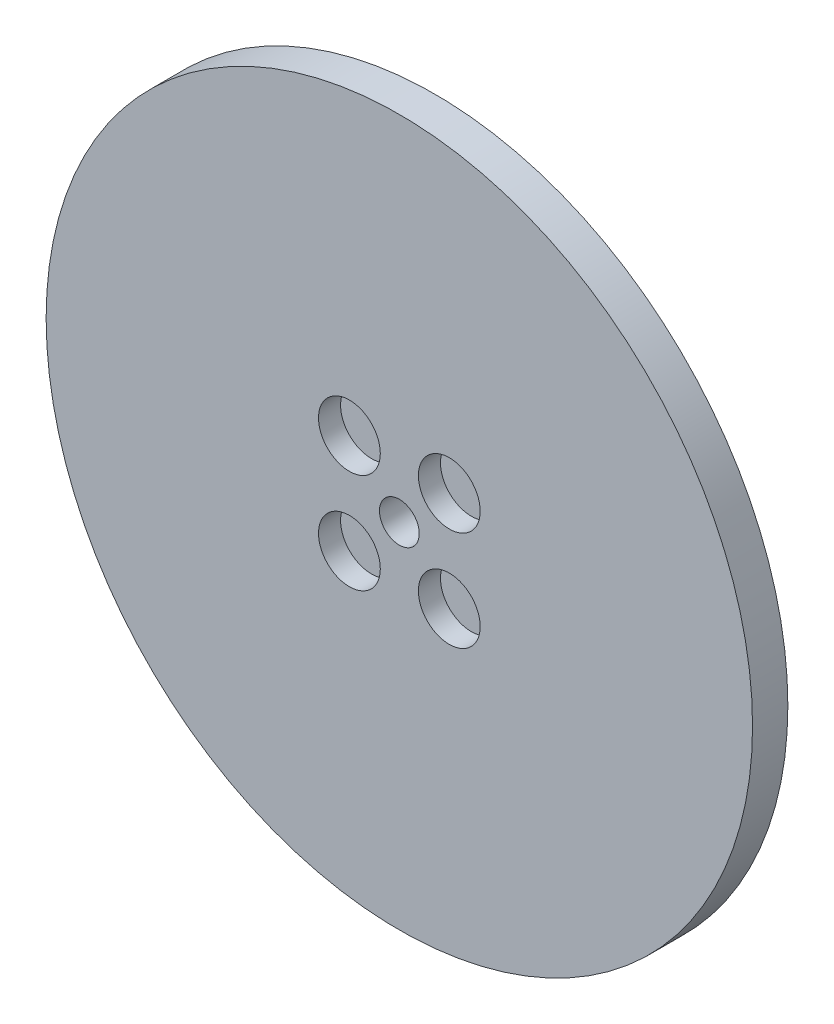
from build123d import *

# Parameters (mm, degrees)
SKETCH1_R           = 30
SKETCH1_R_2         = 12.5
BOSS_EXTRUDE1_DEPTH = 4
SKETCH2_R           = 40
SKETCH2_R_2         = 2.25
SKETCH2_R_3         = 1.5
BOSS_EXTRUDE2_DEPTH = 4
SKETCH3_R           = 3.5
CUT_EXTRUDE1_DEPTH  = 2.5
SKETCH4_R           = 5.15
CUT_EXTRUDE2_DEPTH  = 4
SKETCH5_R           = 3.5
BOSS_EXTRUDE3_DEPTH = 0.2


with BuildPart() as part:
    # Sketch1 → Boss-Extrude1 (new body)
    with BuildSketch(Plane.XY):
        Circle(SKETCH1_R)
        Circle(SKETCH1_R_2, mode=Mode.SUBTRACT)
    extrude(amount=BOSS_EXTRUDE1_DEPTH)

    # Sketch2 → Boss-Extrude2 (add)
    with BuildSketch(Plane.XY.offset(4)):
        Circle(SKETCH2_R)
        Circle(SKETCH2_R_2, mode=Mode.SUBTRACT)
        with Locations((-5.655999742, 5.657708628)):
            Circle(SKETCH2_R_3, mode=Mode.SUBTRACT)
        with Locations((-5.655999742, -5.657708628)):
            Circle(SKETCH2_R_3, mode=Mode.SUBTRACT)
        with Locations((5.655999742, -5.657708628)):
            Circle(SKETCH2_R_3, mode=Mode.SUBTRACT)
        with Locations((5.655999742, 5.657708628)):
            Circle(SKETCH2_R_3, mode=Mode.SUBTRACT)
    extrude(amount=BOSS_EXTRUDE2_DEPTH)

    # Sketch3 → Cut-Extrude1 (cut)
    with BuildSketch(Plane.XY.offset(8)):
        with Locations((-5.655999742, 5.657708628)):
            Circle(SKETCH3_R)
        with Locations((5.655999742, 5.657708628)):
            Circle(SKETCH3_R)
        with Locations((5.655999742, -5.657708628)):
            Circle(SKETCH3_R)
        with Locations((-5.655999742, -5.657708628)):
            Circle(SKETCH3_R)
    extrude(amount=-CUT_EXTRUDE1_DEPTH, mode=Mode.SUBTRACT)

    # Sketch4 → Cut-Extrude2 (cut)
    with BuildSketch(Plane(origin=(0, 0, 0), x_dir=(-1, 0, 0), z_dir=(0, 0, -1))):
        with Locations((-20, 0)):
            Circle(SKETCH4_R)
        with Locations((0, -20)):
            Circle(SKETCH4_R)
        with Locations((20, 0)):
            Circle(SKETCH4_R)
        with Locations((0, 20)):
            Circle(SKETCH4_R)
    extrude(amount=-CUT_EXTRUDE2_DEPTH, mode=Mode.SUBTRACT)

    # Sketch5 → Boss-Extrude3 (add)
    with BuildSketch(Plane.XY.offset(5.5)):
        with Locations((-5.655999742, 5.657708628)):
            Circle(SKETCH5_R)
        with Locations((5.655999742, 5.657708628)):
            Circle(SKETCH5_R)
        with Locations((-5.655999742, -5.657708628)):
            Circle(SKETCH5_R)
        with Locations((5.655999742, -5.657708628)):
            Circle(SKETCH5_R)
    extrude(amount=-BOSS_EXTRUDE3_DEPTH)


solid = part.part
